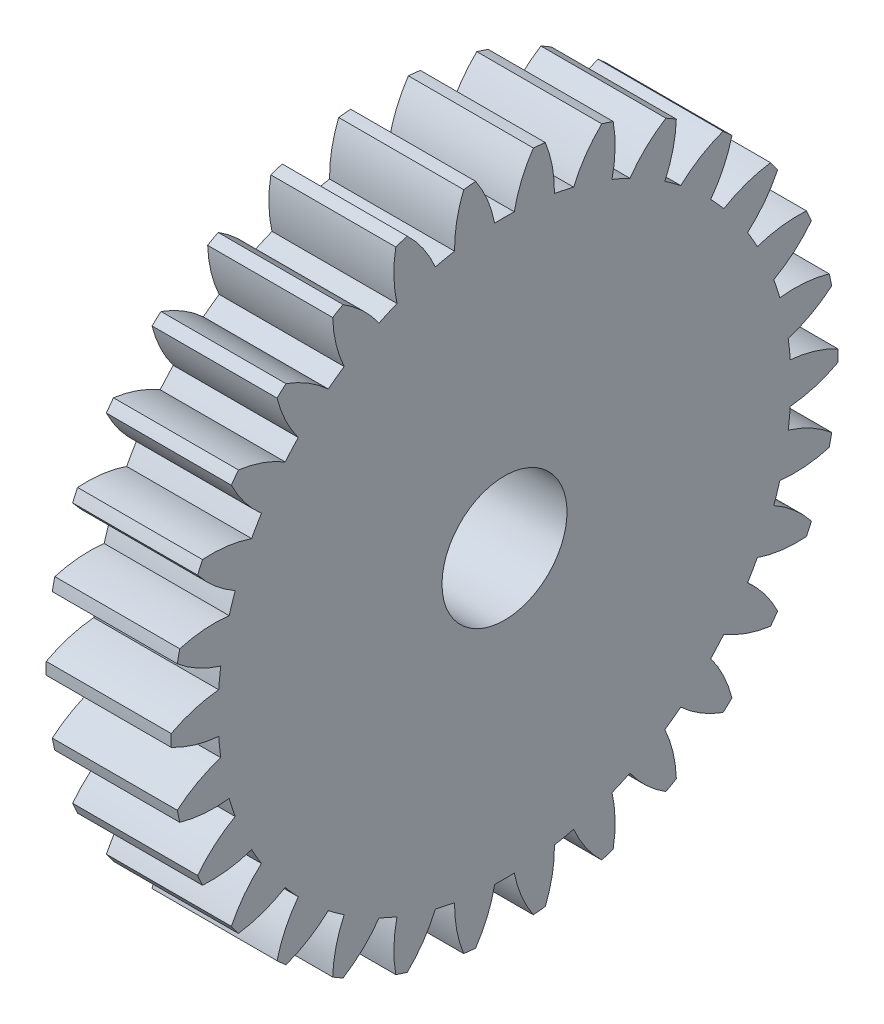
from build123d import *

# Parameters (mm, degrees)
BASPROSKE_W     = 6.35
BASPROSKE_H     = 16.933333333
TOOTHCUT_DEPTH  = 25.774948144
TEETHCUTS_COUNT = 30
TEETHCUTS_ANGLE = 348
BORSKE_R        = 3.175
BORE_DEPTH      = 50.8000508


with BuildPart() as part:
    # BasProSke → Base-Revolve (revolve)
    with BuildSketch(Plane(origin=(0, 0, 0), x_dir=(1, 0, 0), z_dir=(0, 1, 0)), mode=Mode.PRIVATE) as base_revolve_sk:
        with Locations((3.175, 8.466666667)):
            Rectangle(BASPROSKE_W, BASPROSKE_H)
    revolve(base_revolve_sk.sketch.rotate(Axis((-10, 0, 0), (1, 0, 0)), 180), axis=Axis((-10, 0, 0), (1, 0, 0)))

    # TooCutSke → ToothCut (cut, through all)
    with BuildSketch(Plane(origin=(0, 0, 0), x_dir=(0, 0, -1), z_dir=(1, 0, 0))):
        with BuildLine():
            ThreePointArc((0.498170969, 14.545671635), (0, 14.5542), (-0.498170969, 14.545671635))
            ThreePointArc((-0.498170969, 14.545671635), (-0.871491697, 15.769583116), (-1.482606883, 16.893801026))
            ThreePointArc((-1.482606883, 16.893801026), (0, 16.958733333), (1.482606883, 16.893801026))
            ThreePointArc((1.482606883, 16.893801026), (0.871491697, 15.769583116), (0.498170969, 14.545671635))
        make_face()
    toothcut = extrude(amount=TOOTHCUT_DEPTH, mode=Mode.SUBTRACT)

    # TeethCuts: ToothCut ×30 about axis
    teethcuts_axis = Axis((-10, 0, 0), (1, 0, 0))
    for i in range(1, TEETHCUTS_COUNT):
        add(toothcut.rotate(teethcuts_axis, i * TEETHCUTS_ANGLE / (TEETHCUTS_COUNT - 1)), mode=Mode.SUBTRACT)

    # BorSke → Bore (cut, symmetric)
    with BuildSketch(Plane(origin=(0, 0, 0), x_dir=(0, 0, -1), z_dir=(1, 0, 0))):
        with Locations(Location((0, 0, 0), (0, 0, 180))):
            Circle(BORSKE_R)
    extrude(amount=BORE_DEPTH, both=True, mode=Mode.SUBTRACT)


solid = part.part
